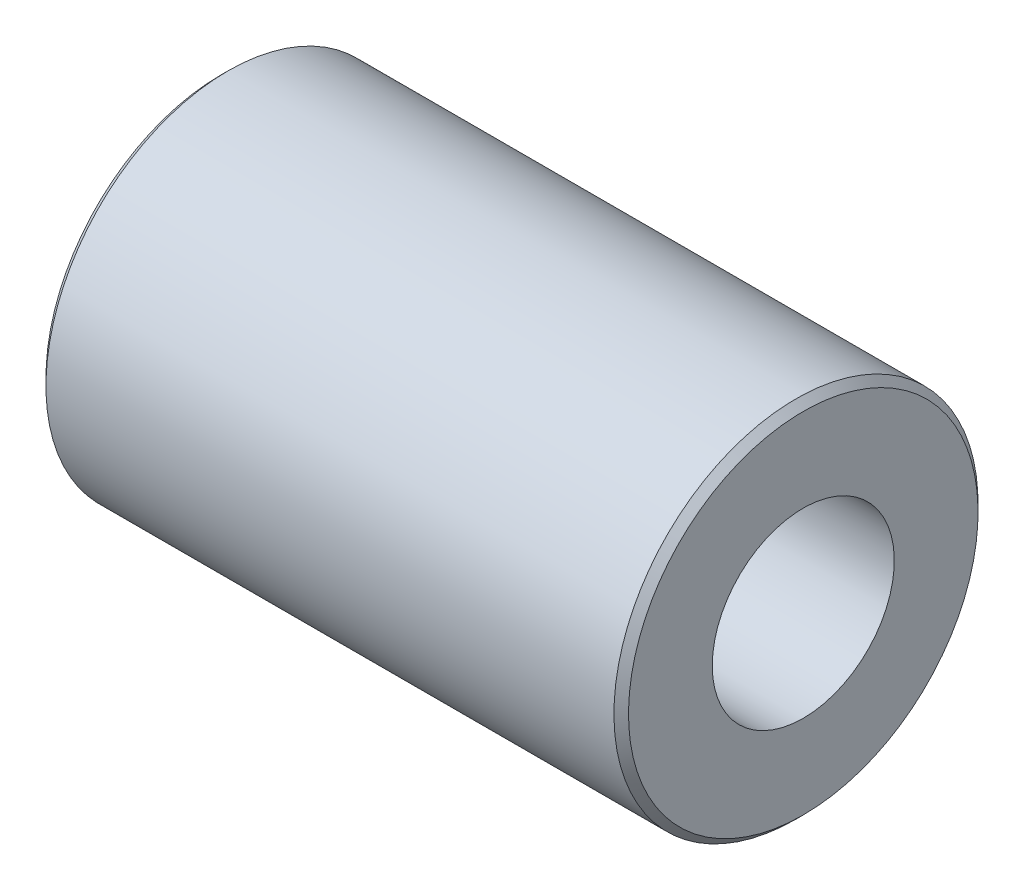
from build123d import *

# Parameters (mm, degrees)
SKETCH_1_W     = 8
SKETCH_1_H     = 2.5
CHAMFER_1_SIZE = 0.1


with BuildPart() as part:
    # 草图1 → 旋转1 (revolve)
    with BuildSketch(Plane.XY, mode=Mode.PRIVATE) as revolve_1_sk:
        with Locations((0, 1.25)):
            Rectangle(SKETCH_1_W, SKETCH_1_H)
    revolve(revolve_1_sk.sketch.rotate(Axis((-4, 0, 0), (1, 0, 0)), 180), axis=Axis((-4, 0, 0), (1, 0, 0)))

    # 草图3 → Hole Wizard 377 (revolve, cut)
    with BuildSketch(Plane(origin=(-4, 0, 0), x_dir=(0, 0, 1), z_dir=(0, 1, 0))):
        Polygon((0, 0), (0, 10.751075774), (1.25, 10), (1.25, 0), align=None)
    hole_wizard_377 = revolve(axis=Axis((-10.35, 0, 0), (1, 0, 0)), mode=Mode.SUBTRACT)

    # 镜向1: Hole Wizard 377 across plane
    add(hole_wizard_377.mirror(Plane(origin=(0, 0, 0), x_dir=(0, 0, 1), z_dir=(1, 0, 0))), mode=Mode.SUBTRACT)

    # 倒角1
    chamfer_1_edges = [part.edges().sort_by_distance(p)[0] for p in [
        (-4, 2.5, 0),
        (4, 2.5, 0),
    ]]
    chamfer(chamfer_1_edges, length=CHAMFER_1_SIZE)


solid = part.part
